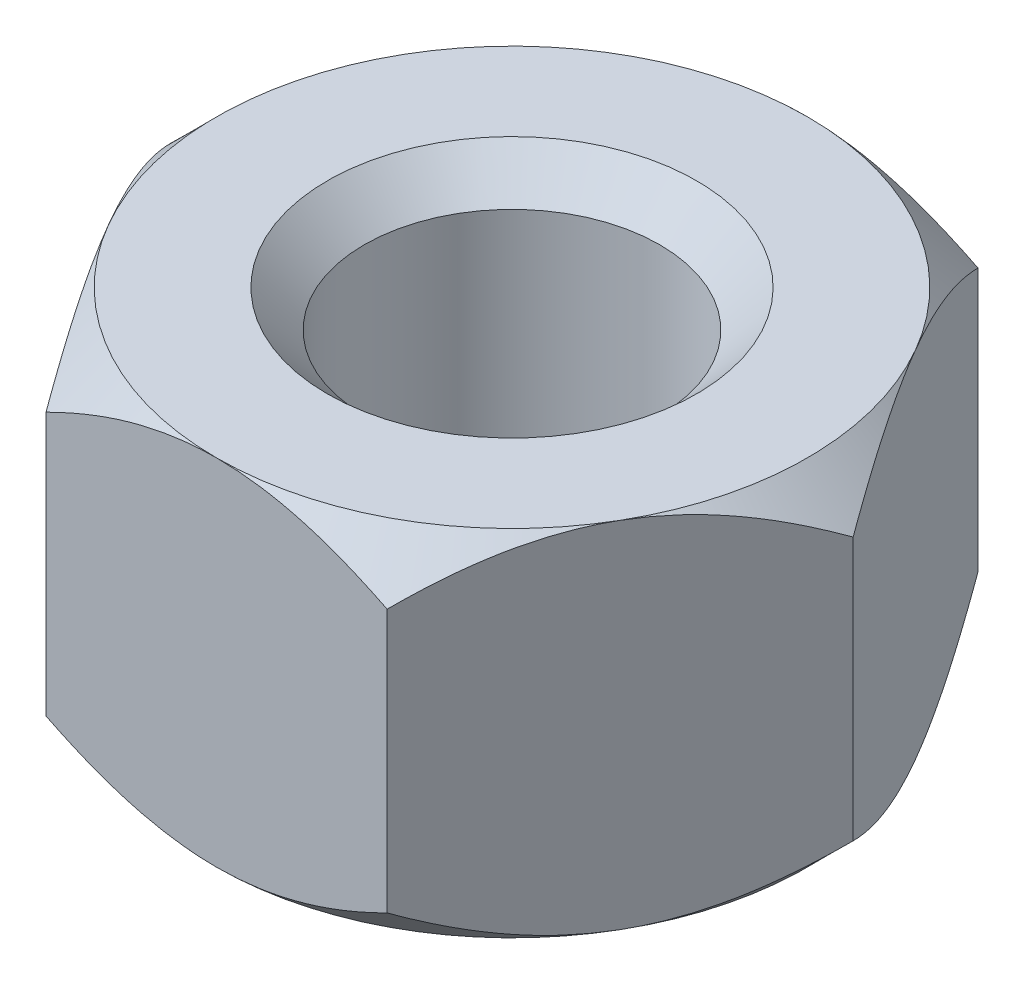
from build123d import *

# Parameters (mm, degrees)
SKETCH1_R           = 1
BOSS_EXTRUDE1_DEPTH = 2.4
CHAMFER2_SIZE       = 0.25


with BuildPart() as part:
    # Sketch1 → Boss-Extrude1 (new body)
    with BuildSketch(Plane(origin=(0, 0, 0), x_dir=(1, 0, 0), z_dir=(0, 1, 0))):
        Polygon((1.154700538, -2), (2.309401077, 0), (1.154700538, 2), (-1.154700538, 2), (-2.309401077, 0), (-1.154700538, -2), align=None)
        Circle(SKETCH1_R, mode=Mode.SUBTRACT)
    extrude(amount=BOSS_EXTRUDE1_DEPTH)

    # Sketch2 → Cut-Revolve1 (revolve, cut)
    with BuildSketch(Plane(origin=(0, 0, 0), x_dir=(0, 0, -1), z_dir=(1, 0, 0))):
        Polygon((2, 2.4), (3.05, 3.45), (3.05, 1.35), align=None)
        Polygon((3.05, 1.05), (2, 0), (3.05, -1.05), align=None)
    revolve(axis=Axis((0, 2.4, 0), (0, -1, 0)), mode=Mode.SUBTRACT)

    # Chamfer2
    chamfer2_edges = [part.edges().sort_by_distance(p)[0] for p in [
        (-1, 2.4, 0),
        (-1, 0, 0),
    ]]
    chamfer(chamfer2_edges, length=CHAMFER2_SIZE)


solid = part.part
